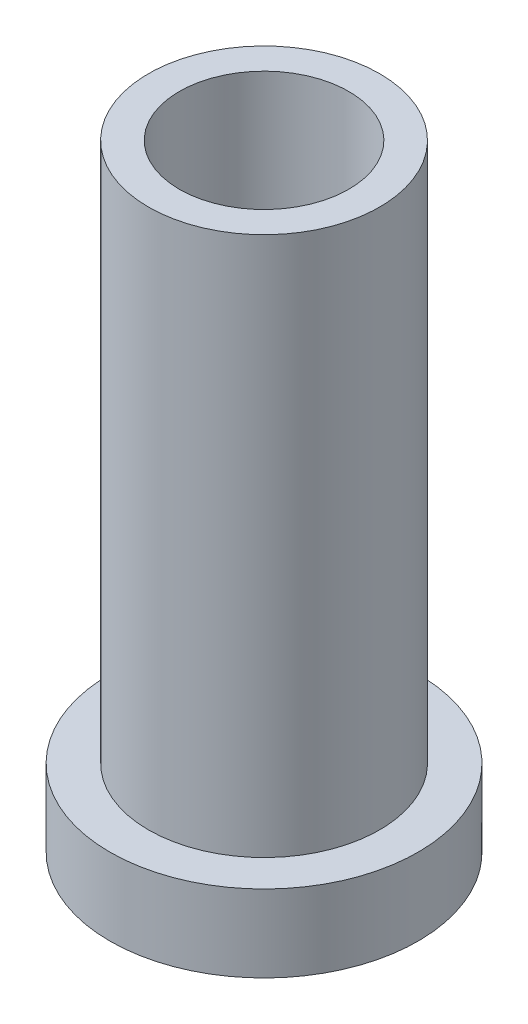
from build123d import *

# Parameters (mm, degrees)
ESBO_O4_R                = 10
RESSALTO_EXTRUS_O3_DEPTH = 5
ESBO_O5_R                = 7.5
RESSALTO_EXTRUS_O4_DEPTH = 35
ESBO_O6_R                = 5.5
CORTE_EXTRUS_O2_DEPTH    = 43.426406871


with BuildPart() as part:
    # Esboço4 → Ressalto-extrusão3 (new body)
    with BuildSketch(Plane(origin=(0, 0, 0), x_dir=(1, 0, 0), z_dir=(0, 1, 0))):
        with Locations(Location((0, 0, 0), (0, 0, 270))):
            Circle(ESBO_O4_R)
    extrude(amount=RESSALTO_EXTRUS_O3_DEPTH)

    # Esboço5 → Ressalto-extrusão4 (add)
    with BuildSketch(Plane(origin=(0, 5, 0), x_dir=(1, 0, 0), z_dir=(0, 1, 0))):
        with Locations(Location((0, 0, 0), (0, 0, 270))):
            Circle(ESBO_O5_R)
    extrude(amount=RESSALTO_EXTRUS_O4_DEPTH)

    # Esboço6 → Corte-extrusão2 (cut, through all)
    with BuildSketch(Plane(origin=(0, 40, 0), x_dir=(1, 0, 0), z_dir=(0, 1, 0))):
        with Locations(Location((0, 0, 0), (0, 0, 270))):
            Circle(ESBO_O6_R)
    extrude(amount=-CORTE_EXTRUS_O2_DEPTH, mode=Mode.SUBTRACT)


solid = part.part
